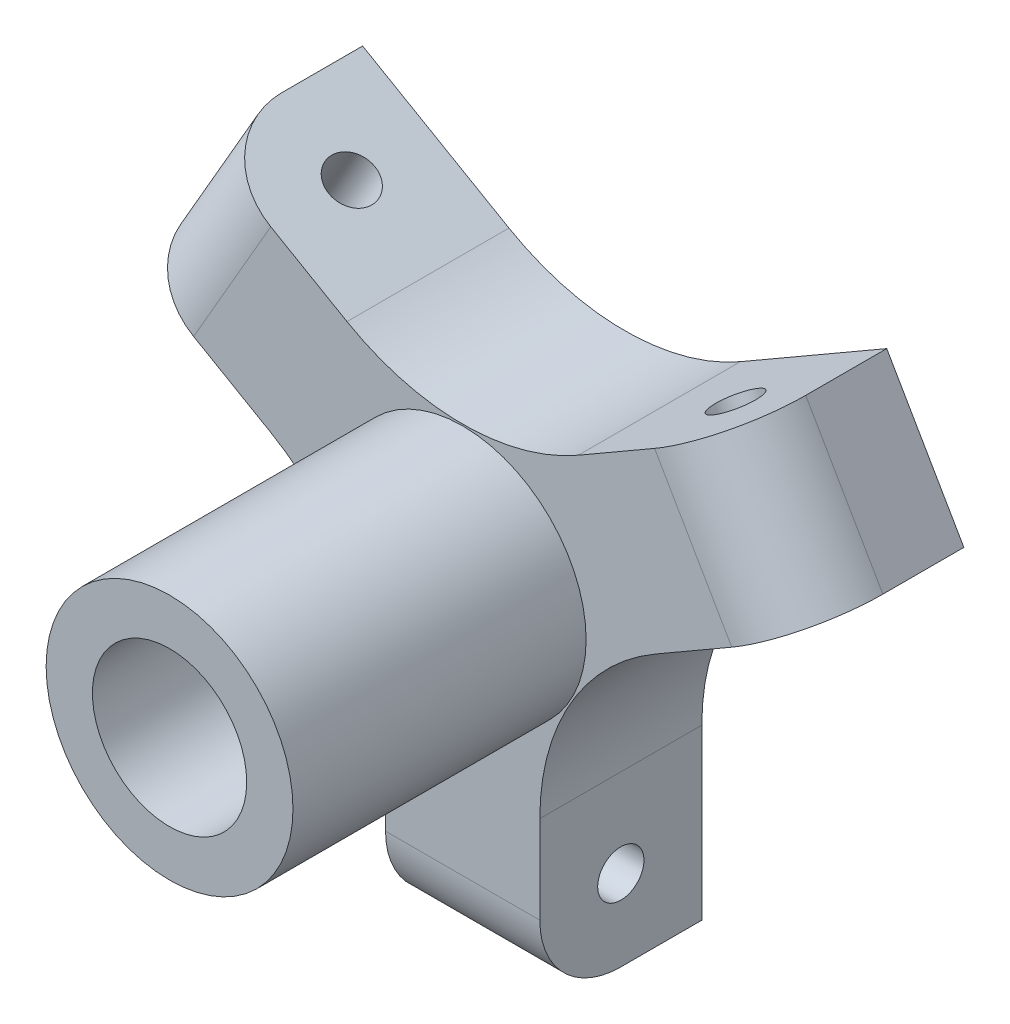
from build123d import *

# Parameters (mm, degrees)
SALIENTE_EXTRUIR1_DEPTH = 21
REDONDEO1_R             = 10.5
CROQUIS2_R              = 16
SALIENTE_EXTRUIR2_DEPTH = 38
CROQUIS3_R              = 10
CORTAR_EXTRUIR1_DEPTH   = 74
CROQUIS4_R              = 3
CORTAR_EXTRUIR2_DEPTH   = 25
MATRIZC1_COUNT          = 3


with BuildPart() as part:
    # Croquis1 → Saliente-Extruir1 (new body)
    with BuildSketch(Plane.XY):
        with BuildLine():
            Line((15, 20.207259422), (33.97114317, 31.160254038))
            Line((33.97114317, 31.160254038), (43.97114317, 13.839745962))
            Line((43.97114317, 13.839745962), (25, 2.886751346))
            ThreePointArc((25, 2.886751346), (14.019237886, -8.094010768), (10, -23.094010768))
            Line((10, -23.094010768), (10, -45))
            Line((10, -45), (-10, -45))
            Line((-10, -45), (-10, -23.094010768))
            ThreePointArc((-10, -23.094010768), (-14.019237886, -8.094010768), (-25, 2.886751346))
            Line((-25, 2.886751346), (-43.97114317, 13.839745962))
            Line((-43.97114317, 13.839745962), (-33.97114317, 31.160254038))
            Line((-33.97114317, 31.160254038), (-15, 20.207259422))
            ThreePointArc((-15, 20.207259422), (0, 16.188021535), (15, 20.207259422))
        make_face()
    extrude(amount=SALIENTE_EXTRUIR1_DEPTH)

    # Redondeo1
    redondeo1_edges = [part.edges().sort_by_distance(p)[0] for p in [
        (38.97114317, 22.5, 21),
        (-38.97114317, 22.5, 21),
        (0, -45, 21),
    ]]
    fillet(redondeo1_edges, radius=REDONDEO1_R)

    # Croquis2 → Saliente-Extruir2 (add)
    with BuildSketch(Plane.XY.offset(21)):
        with Locations(Location((0, 0, 0), (0, 0, 180))):
            Circle(CROQUIS2_R)
    extrude(amount=SALIENTE_EXTRUIR2_DEPTH)

    # Croquis3 → Cortar-Extruir1 (cut)
    with BuildSketch(Plane.XY.offset(59)):
        Circle(CROQUIS3_R)
    extrude(amount=-CORTAR_EXTRUIR1_DEPTH, mode=Mode.SUBTRACT)

    # Croquis4 → Cortar-Extruir2 (cut)
    with BuildSketch(Plane(origin=(5, 8.660254038, 0), x_dir=(0.866025403784439, -0.4999999999999993, 0), z_dir=(0.4999999999999993, 0.866025403784439, 0))):
        with Locations(Location((-34.5, -10.5, 0), (0, 0, 180))):
            Circle(CROQUIS4_R)
    cortar_extruir2 = extrude(amount=-CORTAR_EXTRUIR2_DEPTH, mode=Mode.SUBTRACT)

    # MatrizC1: Cortar-Extruir2 ×3 about axis
    matrizc1_axis = Axis((0, 0, 59), (0, 0, -1))
    for i in range(1, MATRIZC1_COUNT):
        add(cortar_extruir2.rotate(matrizc1_axis, i * 360 / MATRIZC1_COUNT), mode=Mode.SUBTRACT)


solid = part.part
